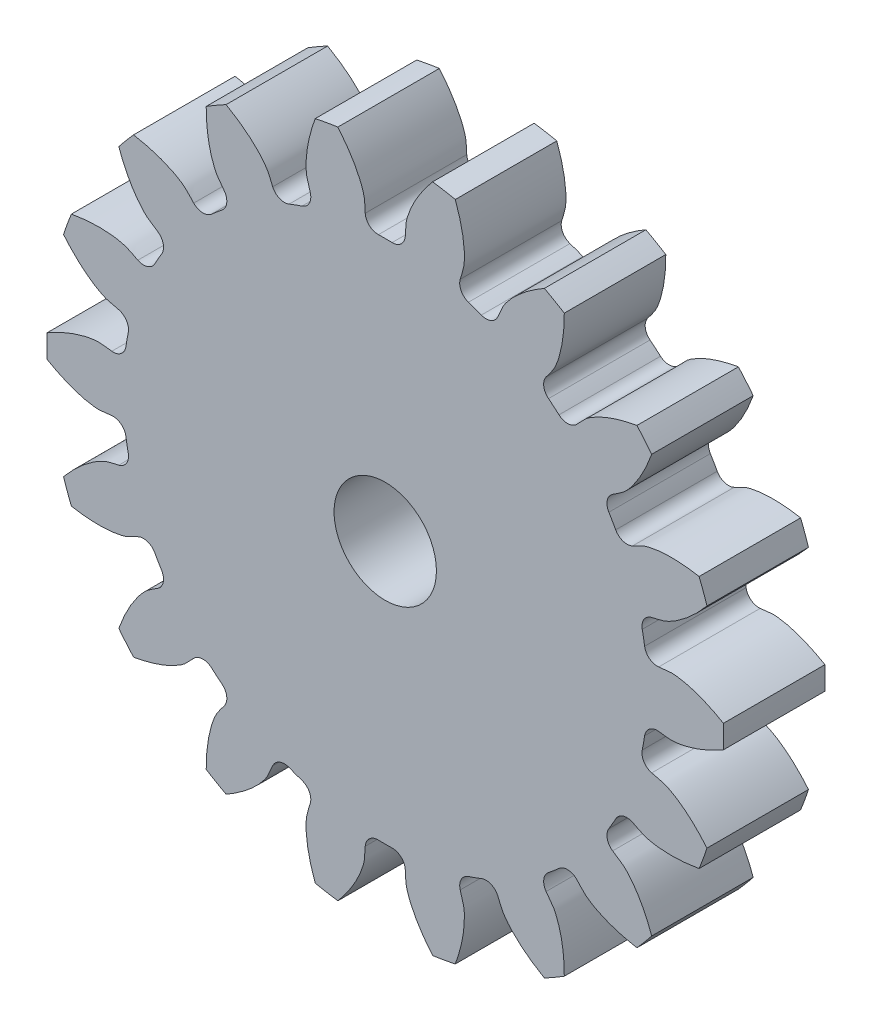
from build123d import *

# Parameters (mm, degrees)
SKETCH_1_R          = 20
LASHENA_DEPTH       = 6
CUT_EXTRUDEA_DEPTH  = 30
WWW_KYTOOL_CN_COUNT = 18
SKETCH_3_R          = 3.025
CUT_EXTRUDE_2_DEPTH = 40


with BuildPart() as part:
    # 草图1 → LaShenA (new body)
    with BuildSketch(Plane.XY):
        Circle(SKETCH_1_R)
    extrude(amount=LASHENA_DEPTH)

    # SketchA → Cut-ExtrudeA (cut)
    with BuildSketch(Plane.XY.offset(6)):
        with BuildLine():
            ThreePointArc((0.404775041, 15.494713846), (0, 15.5), (-0.404775041, 15.494713846))
            ThreePointArc((-0.404775041, 15.494713846), (-0.935854703, 15.692101383), (-1.182811303, 16.202022833))
            add(Edge.make_bspline(
                [(-1.182811303, 16.202022833), (-1.198301169, 16.426013705), (-1.195921675, 16.70448408), (-1.244732343, 17.004432165), (-1.269672878, 17.110588213), (-1.291613183, 17.19459189), (-1.319717838, 17.290747882), (-1.354578309, 17.398798919), (-1.396916584, 17.51842047), (-1.447395743, 17.649271169), (-1.506679889, 17.790977084), (-1.575413708, 17.94313736), (-1.654227452, 18.105323168), (-1.743734042, 18.277078775), (-1.844528615, 18.457922014), (-1.957187356, 18.647344986), (-2.082266579, 18.84481473), (-2.220301763, 19.049773959), (-2.371806627, 19.261641808), (-2.537272243, 19.479814627), (-2.717166144, 19.703666803), (-2.911931548, 19.932551608), (-3.121986292, 20.165802098), (-3.429111162, 20.488155635), (-3.674513166, 20.72451166), (-3.845522424, 20.880546122)],
                knots=[0.120340558, 0.120340558, 0.120340558, 0.120340558, 0.226675273, 0.253182126, 0.264851157, 0.278641828, 0.294554141, 0.312588096, 0.332743693, 0.355020931, 0.37941981, 0.405940331, 0.434582494, 0.465346299, 0.498231745, 0.533238832, 0.570367562, 0.609617933, 0.650989945, 0.6944836, 0.740098896, 0.787835833, 0.837694412, 0.889674633, 1, 1, 1, 1], degree=3))
            ThreePointArc((-3.845522424, 20.880546122), (0, 21.231703866), (3.845522424, 20.880546122))
            add(Edge.make_bspline(
                [(1.182811303, 16.202022833), (1.198301169, 16.426013705), (1.195921675, 16.70448408), (1.244732343, 17.004432165), (1.269672878, 17.110588213), (1.291613183, 17.19459189), (1.319717838, 17.290747882), (1.354578309, 17.398798919), (1.396916584, 17.51842047), (1.447395743, 17.649271169), (1.506679889, 17.790977084), (1.575413708, 17.94313736), (1.654227452, 18.105323168), (1.743734042, 18.277078775), (1.844528615, 18.457922014), (1.957187356, 18.647344986), (2.082266579, 18.84481473), (2.220301763, 19.049773959), (2.371806627, 19.261641808), (2.537272243, 19.479814627), (2.717166144, 19.703666803), (2.911931548, 19.932551608), (3.121986292, 20.165802098), (3.429111162, 20.488155635), (3.674513166, 20.72451166), (3.845522424, 20.880546122)],
                knots=[0.120340558, 0.120340558, 0.120340558, 0.120340558, 0.226675273, 0.253182126, 0.264851157, 0.278641828, 0.294554141, 0.312588096, 0.332743693, 0.355020931, 0.37941981, 0.405940331, 0.434582494, 0.465346299, 0.498231745, 0.533238832, 0.570367562, 0.609617933, 0.650989945, 0.6944836, 0.740098896, 0.787835833, 0.837694412, 0.889674633, 1, 1, 1, 1], degree=3))
            ThreePointArc((1.182811303, 16.202022833), (0.935854703, 15.692101383), (0.404775041, 15.494713846))
        make_face()
    cut_extrudea = extrude(amount=-CUT_EXTRUDEA_DEPTH, mode=Mode.SUBTRACT)

    # www.KYTool.cn: Cut-ExtrudeA ×18 about axis
    www_kytool_cn_axis = Axis((0, 0, -88.99), (0, 0, 1))
    for i in range(1, WWW_KYTOOL_CN_COUNT):
        add(cut_extrudea.rotate(www_kytool_cn_axis, i * 360 / WWW_KYTOOL_CN_COUNT), mode=Mode.SUBTRACT)

    # 草图3 → 切除-拉伸2 (cut)
    with BuildSketch(Plane.XY.offset(6)):
        Circle(SKETCH_3_R)
    extrude(amount=-CUT_EXTRUDE_2_DEPTH, mode=Mode.SUBTRACT)


solid = part.part
